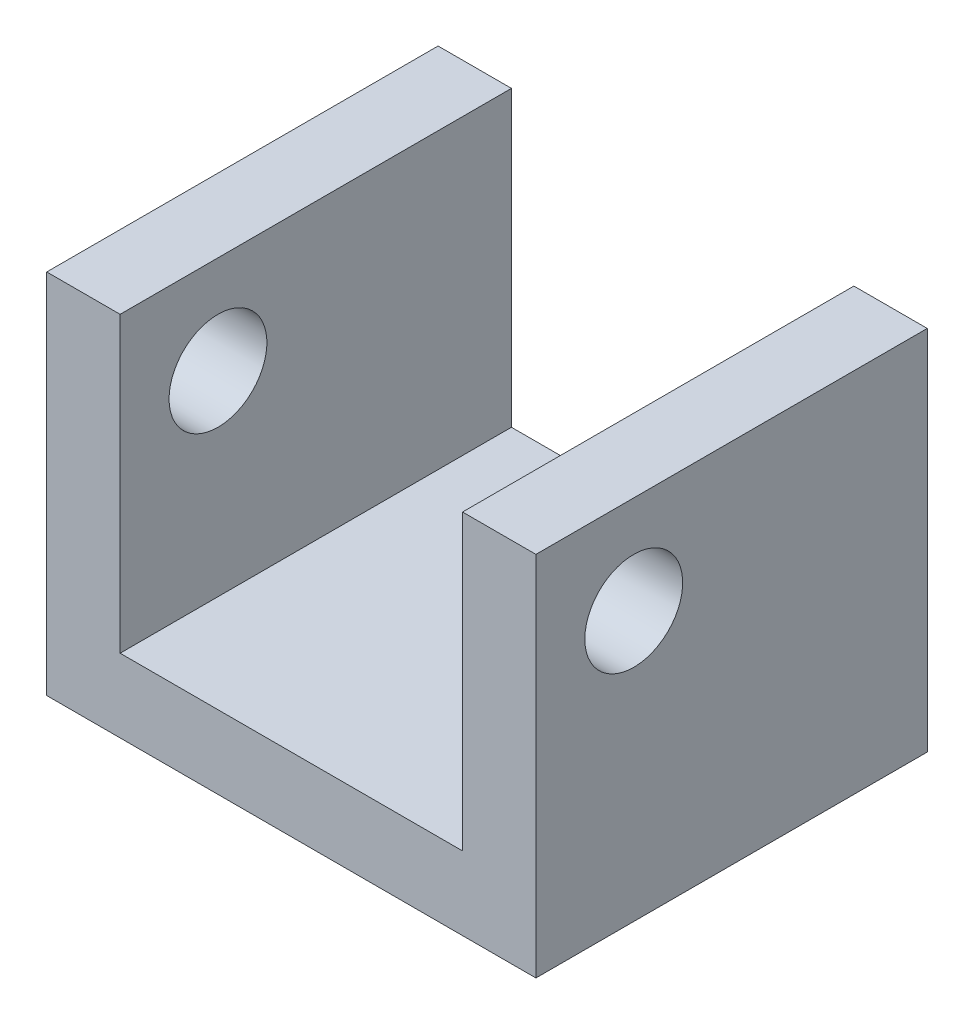
from build123d import *

# Parameters (mm, degrees)
SKETCH1_W           = 10
SKETCH1_H           = 8
BOSS_EXTRUDE1_DEPTH = 1.5
SKETCH3_W           = 1.5
SKETCH3_H           = 8
BOSS_EXTRUDE2_DEPTH = 6
SKETCH4_R           = 1.2
CUT_EXTRUDE1_DEPTH  = 9.774964387
SKETCH5_R           = 1
CUT_EXTRUDE2_DEPTH  = 14.124404748


with BuildPart() as part:
    # Sketch1 → Boss-Extrude1 (new body)
    with BuildSketch(Plane(origin=(0, 0, 0), x_dir=(1, 0, 0), z_dir=(0, 1, 0))):
        Rectangle(SKETCH1_W, SKETCH1_H)
    extrude(amount=BOSS_EXTRUDE1_DEPTH)

    # Sketch3 → Boss-Extrude2 (add)
    with BuildSketch(Plane(origin=(0, 1.5, 0), x_dir=(1, 0, 0), z_dir=(0, 1, 0))):
        with Locations((-4.25, 0)):
            Rectangle(SKETCH3_W, SKETCH3_H)
        with Locations((4.25, 0)):
            Rectangle(SKETCH3_W, SKETCH3_H)
    extrude(amount=BOSS_EXTRUDE2_DEPTH)

    # Sketch4 → Cut-Extrude1 (cut, through all)
    with BuildSketch(Plane(origin=(0, 1.5, 0), x_dir=(1, 0, 0), z_dir=(0, 1, 0))):
        with Locations(Location((0, 1.734711092, 0), (0, 0, 270))):
            Circle(SKETCH4_R)
    extrude(amount=-CUT_EXTRUDE1_DEPTH, mode=Mode.SUBTRACT)

    # Sketch5 → Cut-Extrude2 (cut, through all)
    with BuildSketch(Plane.ZY.offset(5)):
        with Locations((2, 5.5)):
            Circle(SKETCH5_R)
    extrude(amount=-CUT_EXTRUDE2_DEPTH, mode=Mode.SUBTRACT)


solid = part.part
